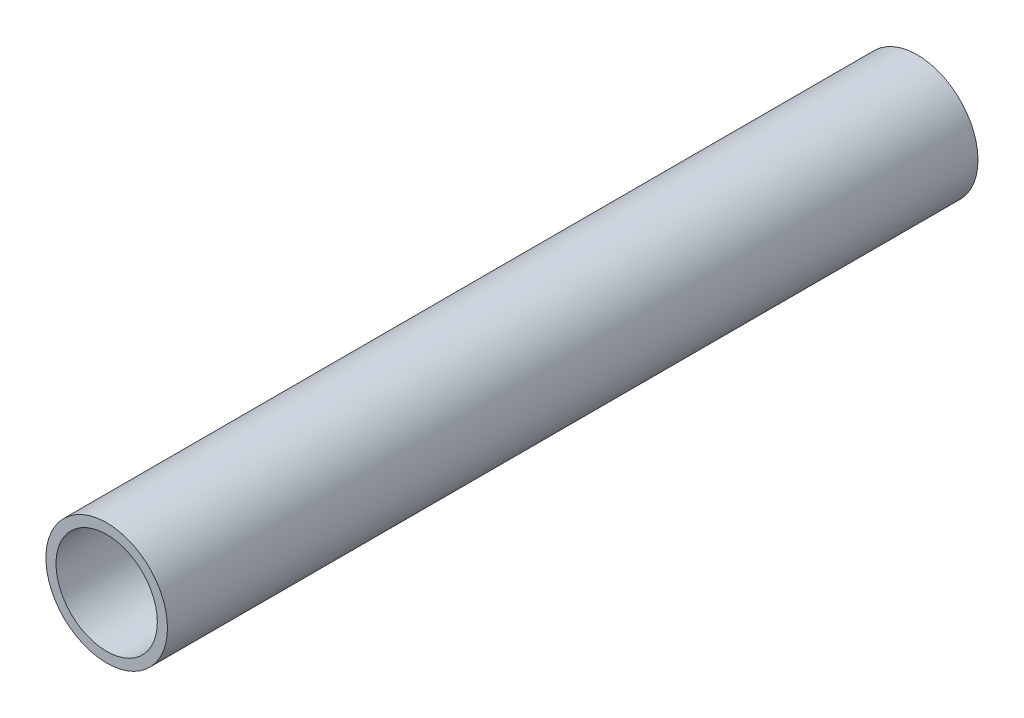
from build123d import *

# Parameters (mm, degrees)
SKETCH_1_R      = 6
SKETCH_1_R_2    = 5
EXTRUDE_1_DEPTH = 80


with BuildPart() as part:
    # 草图1 → 凸台-拉伸1 (new body)
    with BuildSketch(Plane.XY):
        Circle(SKETCH_1_R)
        Circle(SKETCH_1_R_2, mode=Mode.SUBTRACT)
    extrude(amount=EXTRUDE_1_DEPTH)


solid = part.part
